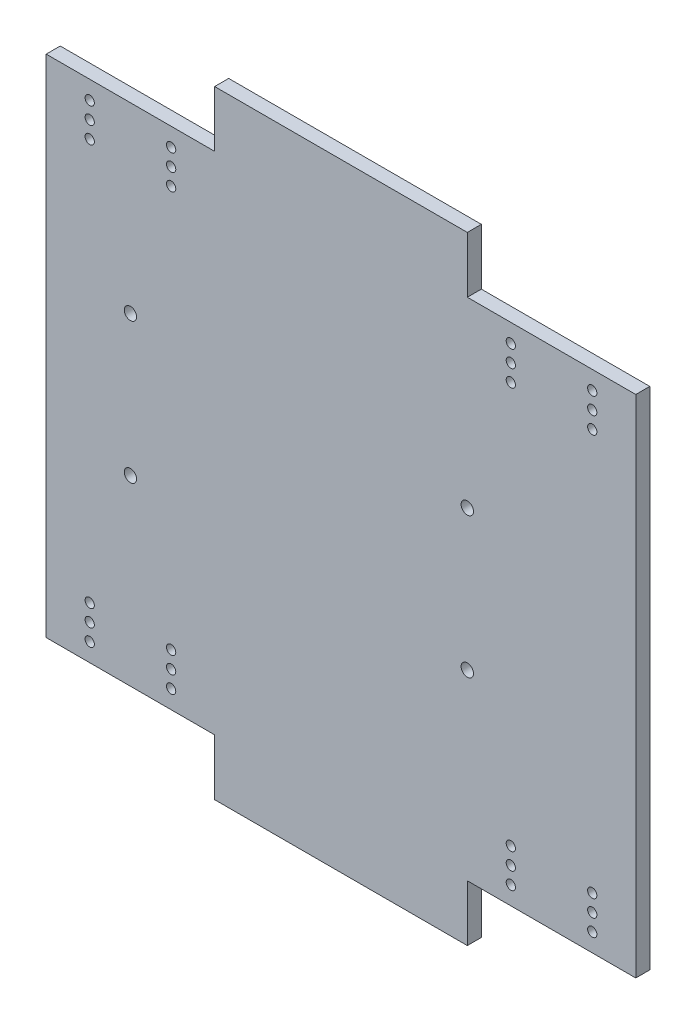
from build123d import *

# Parameters (mm, degrees)
SKETCH2_W           = 210
SKETCH2_H           = 180
BOSS_EXTRUDE1_DEPTH = 5
SKETCH3_W           = 90
SKETCH3_H           = 5
BOSS_EXTRUDE2_DEPTH = 20
SKETCH4_W           = 90
SKETCH4_H           = 5
BOSS_EXTRUDE3_DEPTH = 20
SKETCH5_R           = 1.65
SKETCH5_R_2         = 2.2
CUT_EXTRUDE1_DEPTH  = 153.151240547


with BuildPart() as part:
    # Sketch2 → Boss-Extrude1 (new body)
    with BuildSketch(Plane.XY):
        Rectangle(SKETCH2_W, SKETCH2_H)
    extrude(amount=BOSS_EXTRUDE1_DEPTH)

    # Sketch3 → Boss-Extrude2 (add)
    with BuildSketch(Plane(origin=(0, -90, 0), x_dir=(-1, 0, 0), z_dir=(0, -1, 0))):
        with Locations((0, -2.5)):
            Rectangle(SKETCH3_W, SKETCH3_H)
    extrude(amount=BOSS_EXTRUDE2_DEPTH)

    # Sketch4 → Boss-Extrude3 (add)
    with BuildSketch(Plane(origin=(0, 90, 0), x_dir=(1, 0, 0), z_dir=(0, 1, 0))):
        with Locations((0, -2.5)):
            Rectangle(SKETCH4_W, SKETCH4_H)
    extrude(amount=BOSS_EXTRUDE3_DEPTH)

    # Sketch5 → Cut-Extrude1 (cut, through all)
    with BuildSketch(Plane.XY.offset(5)):
        with Locations((89.5, 83.5)):
            Circle(SKETCH5_R)
        with Locations((89.5, 77.5)):
            Circle(SKETCH5_R)
        with Locations((89.5, 71.5)):
            Circle(SKETCH5_R)
        with Locations((60.5, 83.5)):
            Circle(SKETCH5_R)
        with Locations((60.5, 77.5)):
            Circle(SKETCH5_R)
        with Locations((60.5, 71.5)):
            Circle(SKETCH5_R)
        with Locations(Location((-60.5, 71.5, 0), (0, 0, 180))):
            Circle(SKETCH5_R)
        with Locations(Location((-60.5, 77.5, 0), (0, 0, 180))):
            Circle(SKETCH5_R)
        with Locations(Location((-60.5, 83.5, 0), (0, 0, 180))):
            Circle(SKETCH5_R)
        with Locations(Location((-89.5, 71.5, 0), (0, 0, 180))):
            Circle(SKETCH5_R)
        with Locations(Location((-89.5, 77.5, 0), (0, 0, 180))):
            Circle(SKETCH5_R)
        with Locations(Location((-89.5, 83.5, 0), (0, 0, 180))):
            Circle(SKETCH5_R)
        with Locations((-89.5, -83.5)):
            Circle(SKETCH5_R)
        with Locations((-89.5, -77.5)):
            Circle(SKETCH5_R)
        with Locations((-89.5, -71.5)):
            Circle(SKETCH5_R)
        with Locations((-60.5, -83.5)):
            Circle(SKETCH5_R)
        with Locations((-60.5, -77.5)):
            Circle(SKETCH5_R)
        with Locations((-60.5, -71.5)):
            Circle(SKETCH5_R)
        with Locations(Location((60.5, -71.5, 0), (0, 0, 180))):
            Circle(SKETCH5_R)
        with Locations(Location((60.5, -77.5, 0), (0, 0, 180))):
            Circle(SKETCH5_R)
        with Locations(Location((60.5, -83.5, 0), (0, 0, 180))):
            Circle(SKETCH5_R)
        with Locations(Location((89.5, -71.5, 0), (0, 0, 180))):
            Circle(SKETCH5_R)
        with Locations(Location((89.5, -77.5, 0), (0, 0, 180))):
            Circle(SKETCH5_R)
        with Locations(Location((89.5, -83.5, 0), (0, 0, 180))):
            Circle(SKETCH5_R)
        with Locations((45, 25)):
            Circle(SKETCH5_R_2)
        with Locations((45, -25)):
            Circle(SKETCH5_R_2)
        with Locations((-75, 25)):
            Circle(SKETCH5_R_2)
        with Locations((-75, -25)):
            Circle(SKETCH5_R_2)
    extrude(amount=-CUT_EXTRUDE1_DEPTH, mode=Mode.SUBTRACT)


solid = part.part
